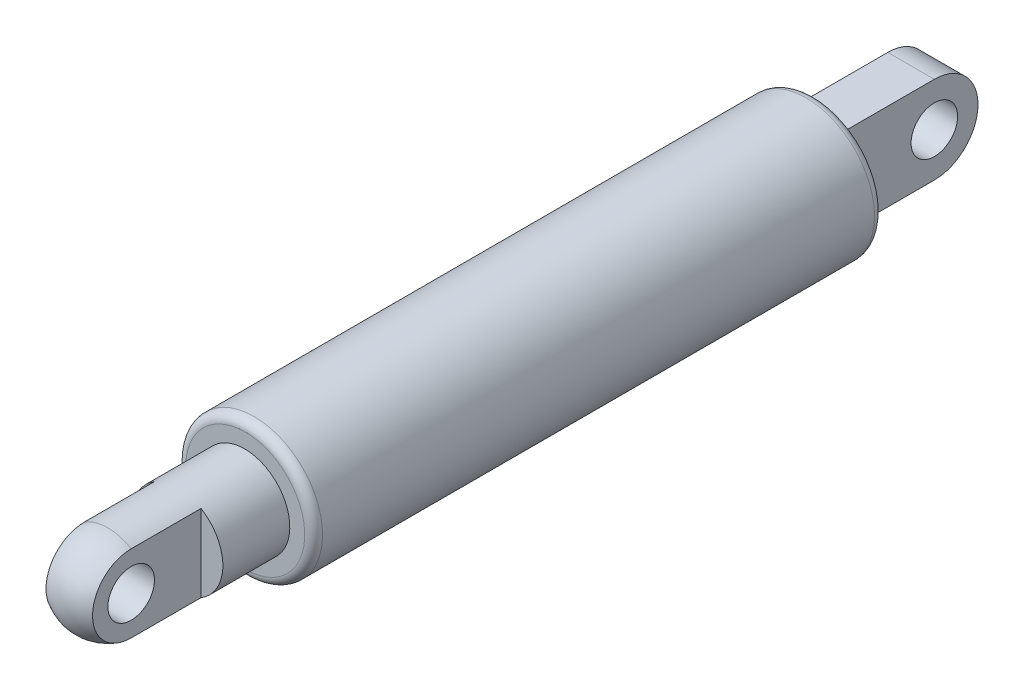
from build123d import *

# Parameters (mm, degrees)
FILLET2_R               = 0.77724
SKETCH2_R               = 2.032
EXTRUDE2_DEPTH          = 2.032
SKETCH9_W               = 32.3088
SKETCH9_H               = 2.032
CUT_EXTRUDE1_DEPTH      = 50.743486078
CUT_EXTRUDE1_DEPTH_BACK = 50.743486078
SKETCH12_R              = 2.032
CUT_EXTRUDE2_DEPTH      = 95.358350575
CUT_EXTRUDE2_DEPTH_BACK = 6.096
SKETCH13_OUTSIDE_W      = 33.81
SKETCH13_OUTSIDE_H      = 33.81
SKETCH13_OUTSIDE_W_2    = 4.064
SKETCH13_OUTSIDE_H_2    = 7.874
LPATTERN1_COUNT         = 2
LPATTERN1_PITCH         = 20.066


with BuildPart() as part:
    # Sketch1 → Revolve1 (revolve)
    with BuildSketch(Plane(origin=(0, 0, 0), x_dir=(0, 0, -1), z_dir=(1, 0, 0)), mode=Mode.PRIVATE) as revolve1_sk:
        Polygon((36.703, 0), (36.703, 5.969), (-13.0302, 5.969), (-13.0302, 2.0828), (7.0866, 2.0828), (19.2786, 2.0828), (19.2786, 0), align=None)
    revolve(revolve1_sk.sketch.rotate(Axis((0, 0, 45.085), (0, 0, -1)), 90), axis=Axis((0, 0, 45.085), (0, 0, -1)))

    # Fillet2
    fillet2_edges = [part.edges().sort_by_distance(p)[0] for p in [
        (-5.969, 0, 13.0302),
        (-5.969, 0, -36.703),
    ]]
    fillet(fillet2_edges, radius=FILLET2_R)

    # Sketch2 → Extrude2 (add, symmetric)
    with BuildSketch(Plane(origin=(0, 0, 0), x_dir=(0, 0, -1), z_dir=(1, 0, 0))):
        with BuildLine():
            Line((36.703, 3.81), (45.085, 3.81))
            ThreePointArc((45.085, 3.81), (48.895, 0), (45.085, -3.81))
            Line((45.085, -3.81), (36.703, -3.81))
            Line((36.703, -3.81), (36.703, 3.81))
        make_face()
        with Locations((45.085, 0)):
            Circle(SKETCH2_R, mode=Mode.SUBTRACT)
    extrude(amount=EXTRUDE2_DEPTH, both=True)


with BuildPart() as body_2:
    # Sketch9 → Revolve5 (revolve)
    with BuildSketch(Plane(origin=(0, 0, 0), x_dir=(0, 0, -1), z_dir=(1, 0, 0)), mode=Mode.PRIVATE) as revolve5_sk:
        with Locations((-16.9926, 1.016)):
            Rectangle(SKETCH9_W, SKETCH9_H)
    revolve(revolve5_sk.sketch.rotate(Axis((0, 0, 33.147), (0, 0, 1)), 90), axis=Axis((0, 0, 33.147), (0, 0, 1)))

    # Sketch11 → Revolve6 (revolve)
    with BuildSketch(Plane(origin=(0, 0, 0), x_dir=(0, 0, -1), z_dir=(1, 0, 0))):
        with BuildLine():
            Line((-33.147, 0), (-33.147, 3.937))
            Line((-33.147, 3.937), (-45.085, 3.937))
            ThreePointArc((-45.085, 3.937), (-47.868879398, 2.783879398), (-49.022, 0))
            Line((-49.022, 0), (-33.147, 0))
        make_face()
    revolve(axis=Axis((0, 0, 49.022), (0, 0, 1)))

    # Sketch12 → Cut-Extrude1 (cut, two sides: drawn at the far end of the back side and taken through both)
    with BuildSketch(Plane(origin=(0, 0, 0), x_dir=(0, 0, -1), z_dir=(1, 0, 0)).offset(-CUT_EXTRUDE1_DEPTH_BACK)):
        with Locations(Location((-45.085, 0, 0), (0, 0, 90))):
            Circle(SKETCH12_R)
    extrude(amount=CUT_EXTRUDE1_DEPTH + CUT_EXTRUDE1_DEPTH_BACK, mode=Mode.SUBTRACT)

    # Sketch13 outside → Cut-Extrude2 (cut, two sides: drawn at the far end of the back side and taken through both)
    with BuildSketch(Plane.XY.offset(45.085).offset(-CUT_EXTRUDE2_DEPTH_BACK)):
        Rectangle(SKETCH13_OUTSIDE_W, SKETCH13_OUTSIDE_H)
        Rectangle(SKETCH13_OUTSIDE_W_2, SKETCH13_OUTSIDE_H_2, mode=Mode.SUBTRACT)
    extrude(amount=CUT_EXTRUDE2_DEPTH + CUT_EXTRUDE2_DEPTH_BACK, mode=Mode.SUBTRACT)


with BuildPart() as lpattern1_1:
    # LPattern1: pattern copy
    add(body_2.part.moved(Location(Vector(0, 0, -1) * (1 * LPATTERN1_PITCH))))


solid = Compound([part.part, lpattern1_1.part])
